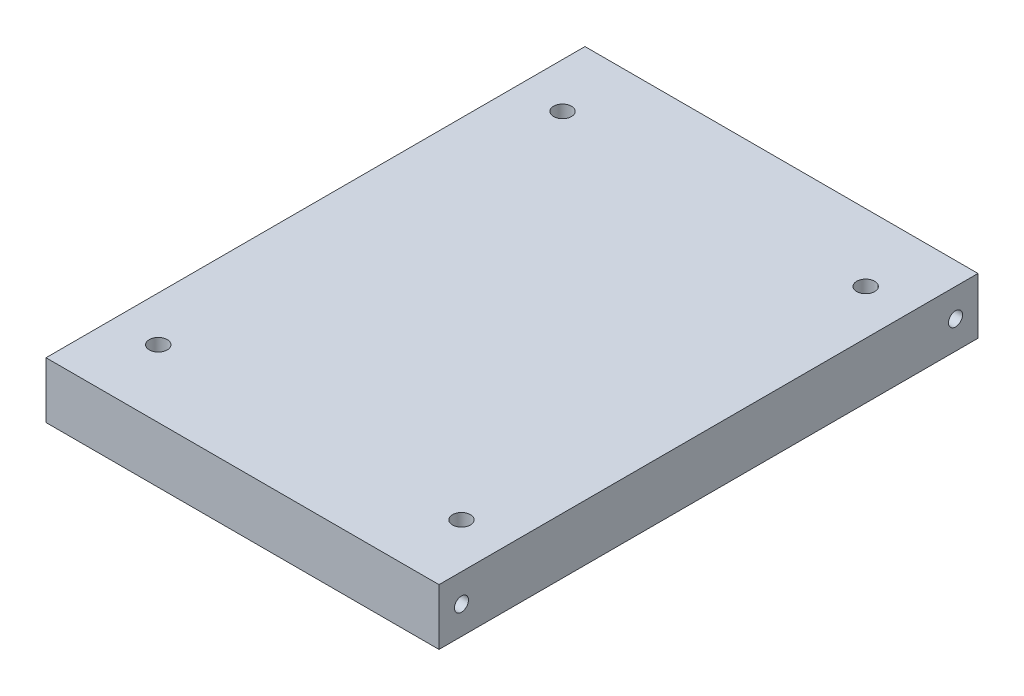
from build123d import *

# Parameters (mm, degrees)
SKETCH1_W           = 70
SKETCH1_H           = 96
SKETCH1_R           = 1.6
BOSS_EXTRUDE1_DEPTH = 10
SKETCH2_R           = 1.25
CUT_EXTRUDE1_DEPTH  = 10


with BuildPart() as part:
    # Sketch1 → Boss-Extrude1 (new body)
    with BuildSketch(Plane.XZ.offset(-316.566699204)):
        with Locations((0, 23.58434623)):
            Rectangle(SKETCH1_W, SKETCH1_H)
        with Locations(Location((-27, 59.58434623, 0), (0, 0, 270))):
            Circle(SKETCH1_R, mode=Mode.SUBTRACT)
        with Locations(Location((27, 59.58434623, 0), (0, 0, 270))):
            Circle(SKETCH1_R, mode=Mode.SUBTRACT)
        with Locations(Location((-27, -12.41565377, 0), (0, 0, 270))):
            Circle(SKETCH1_R, mode=Mode.SUBTRACT)
        with Locations(Location((27, -12.41565377, 0), (0, 0, 270))):
            Circle(SKETCH1_R, mode=Mode.SUBTRACT)
    extrude(amount=BOSS_EXTRUDE1_DEPTH)

    # Sketch2 → Cut-Extrude1 (cut)
    with BuildSketch(Plane.ZY.offset(35)):
        with Locations((-20.41565377, 311.566699204)):
            Circle(SKETCH2_R)
        with Locations((67.58434623, 311.566699204)):
            Circle(SKETCH2_R)
    cut_extrude1 = extrude(amount=-CUT_EXTRUDE1_DEPTH, mode=Mode.SUBTRACT)

    # Mirror1: Cut-Extrude1 across plane
    add(cut_extrude1.mirror(Plane(origin=(0, 0, 0), x_dir=(0, 0, 1), z_dir=(1, 0, 0))), mode=Mode.SUBTRACT)


solid = part.part
